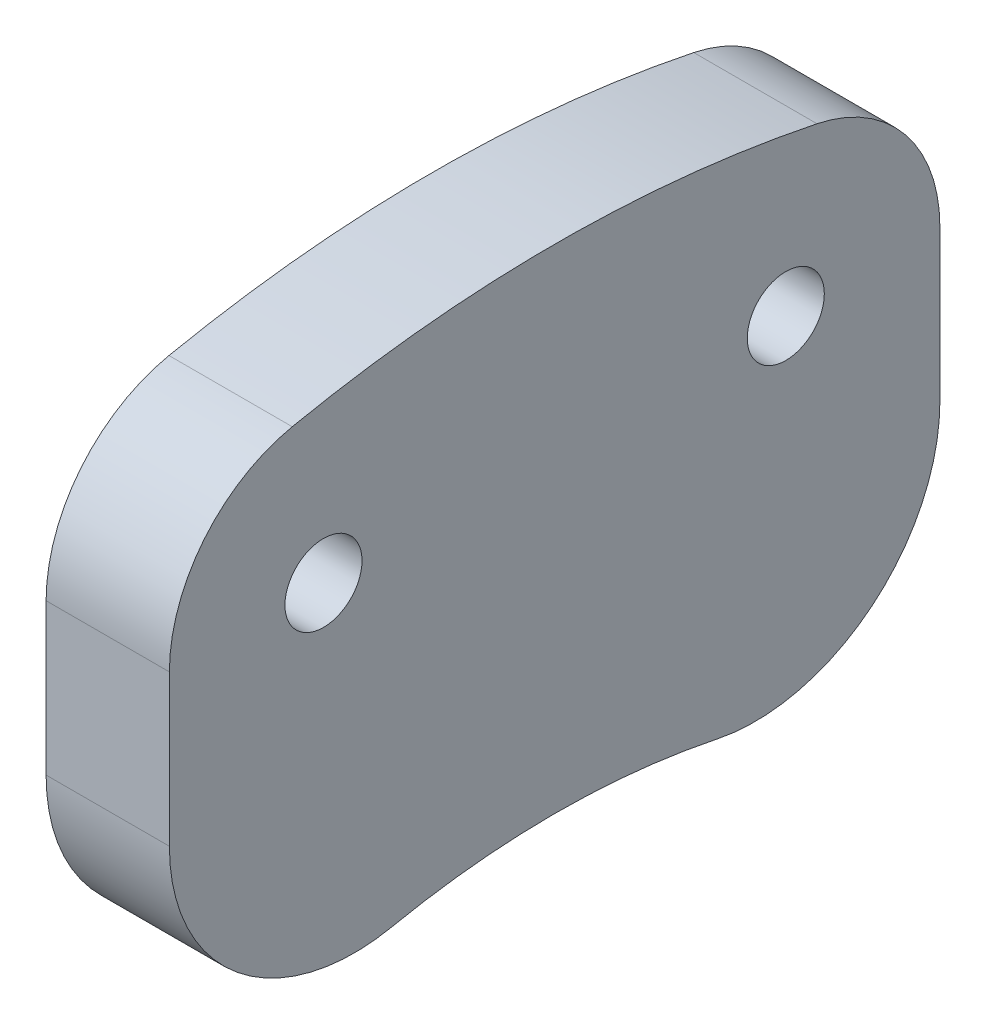
from build123d import *

# Parameters (mm, degrees)
SKETCH2_R             = 3
BOSS_EXTRUDE1_DEPTH   = 4
FILLET1_R             = 6
M3X0_5_TAPPED_HOLE1_D = 2.5


with BuildPart() as part:
    # Sketch2 → Boss-Extrude1 (new body)
    # profile 1 of 2: a face of its own
    with BuildSketch(Plane(origin=(0, 0, 0), x_dir=(0, 0, -1), z_dir=(1, 0, 0))):
        with BuildLine():
            Line((12.5, 9.80532533), (12.5, -3.628540469))
            ThreePointArc((12.5, -3.628540469), (0, -0.426566699), (-12.5, -3.628540469))
            Line((-12.5, -3.628540469), (-12.5, 9.80532533))
            ThreePointArc((-12.5, 9.80532533), (-11.377342361, 12.962256786), (-8.513513514, 14.701526956))
            ThreePointArc((-8.513513514, 14.701526956), (0, 15.573433301), (8.513513514, 14.701526956))
            ThreePointArc((8.513513514, 14.701526956), (11.377342361, 12.962256786), (12.5, 9.80532533))
        make_face()
        with Locations((0, 10.573433301)):
            Circle(SKETCH2_R, mode=Mode.SUBTRACT)
    # profile 2 of 2: a face of its own
    with BuildSketch(Plane(origin=(0, 0, 0), x_dir=(0, 0, -1), z_dir=(1, 0, 0))):
        with Locations((0, 10.573433301)):
            Circle(SKETCH2_R)
    extrude(amount=BOSS_EXTRUDE1_DEPTH)

    # Fillet1
    fillet1_edges = [part.edges().sort_by_distance(p)[0] for p in [
        (2, -3.628540469, -12.5),
        (2, -3.628540469, 12.5),
    ]]
    fillet(fillet1_edges, radius=FILLET1_R)

    # M3x0.5 Tapped Hole1 (through all)
    with Locations(Plane.ZY):
        with Locations((-7.5, 9.80532533), (7.5, 9.80532533)):
            Hole(M3X0_5_TAPPED_HOLE1_D / 2)


solid = part.part
